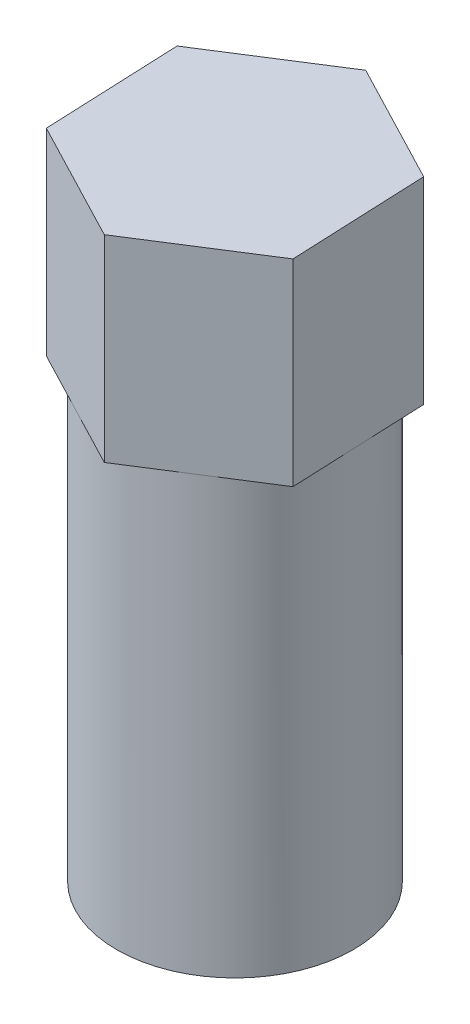
from build123d import *

# Parameters (mm, degrees)
BOSS_EXTRUDE1_DEPTH = 10
SKETCH6_R           = 6
BOSS_EXTRUDE2_DEPTH = 22


with BuildPart() as part:
    # Sketch1 → Boss-Extrude1 (new body)
    with BuildSketch(Plane(origin=(0, 0, 0), x_dir=(1, 0, 0), z_dir=(0, 1, 0))):
        Polygon((6.142439995, -3.204751302), (5.846616038, 3.717133426), (-0.295823957, 6.921884728), (-6.142439995, 3.204751302), (-5.846616038, -3.717133426), (0.295823957, -6.921884728), align=None)
    extrude(amount=BOSS_EXTRUDE1_DEPTH)

    # Sketch6 → Boss-Extrude2 (add)
    with BuildSketch(Plane.XZ):
        with Locations(Location((0, 0, 0), (0, 0, 117.552811577))):
            Circle(SKETCH6_R)
    extrude(amount=BOSS_EXTRUDE2_DEPTH)


solid = part.part
